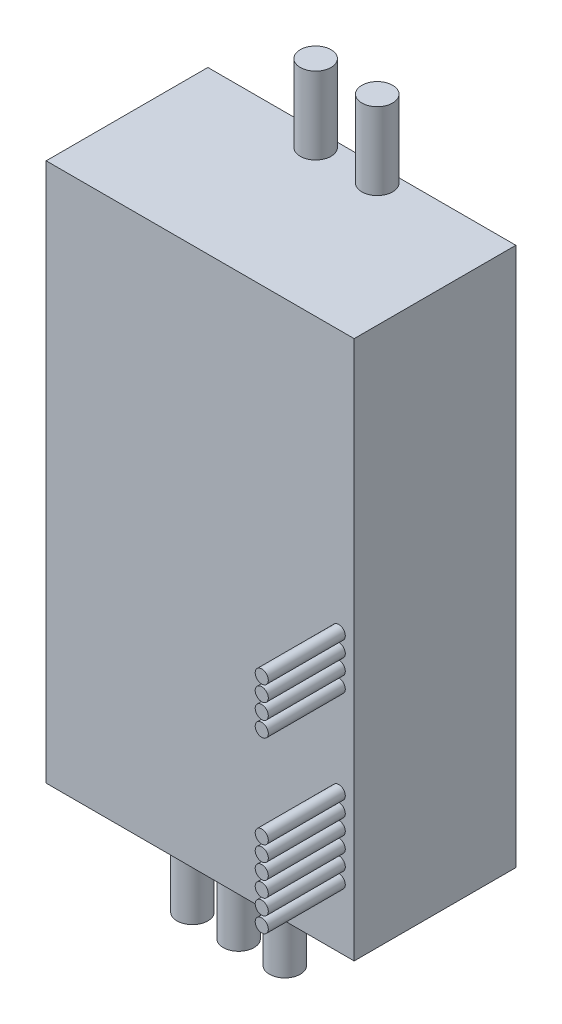
from build123d import *

# Parameters (mm, degrees)
SKETCH1_W           = 70
SKETCH1_H           = 40
BOSS_EXTRUDE1_DEPTH = 21
SKETCH2_R           = 2
BOSS_EXTRUDE2_DEPTH = 10
SKETCH3_R           = 2
BOSS_EXTRUDE3_DEPTH = 10
SKETCH4_R           = 0.85
BOSS_EXTRUDE4_DEPTH = 10


with BuildPart() as part:
    # Sketch1 → Boss-Extrude1 (new body)
    with BuildSketch(Plane(origin=(0, 0, 0), x_dir=(0, 1, 0), z_dir=(0, 0, 1))):
        Rectangle(SKETCH1_W, SKETCH1_H)
    extrude(amount=BOSS_EXTRUDE1_DEPTH)

    # Sketch2 → Boss-Extrude2 (add)
    with BuildSketch(Plane.XZ.offset(35)):
        with Locations((-6, 16)):
            Circle(SKETCH2_R)
        with Locations((0, 16)):
            Circle(SKETCH2_R)
        with Locations((6, 16)):
            Circle(SKETCH2_R)
    extrude(amount=BOSS_EXTRUDE2_DEPTH)

    # Sketch3 → Boss-Extrude3 (add)
    with BuildSketch(Plane(origin=(0, 35, 0), x_dir=(-1, 0, 0), z_dir=(0, 1, 0))):
        with Locations(Location((-4, 2, 0), (0, 0, 270))):
            Circle(SKETCH3_R)
        with Locations(Location((4, 2, 0), (0, 0, 270))):
            Circle(SKETCH3_R)
    extrude(amount=BOSS_EXTRUDE3_DEPTH)

    # Sketch4 → Boss-Extrude4 (add)
    with BuildSketch(Plane.XY.offset(21)):
        with Locations((18, -27)):
            Circle(SKETCH4_R)
        with Locations((18, -25)):
            Circle(SKETCH4_R)
        with Locations((18, -23)):
            Circle(SKETCH4_R)
        with Locations((18, -21)):
            Circle(SKETCH4_R)
        with Locations((18, -19)):
            Circle(SKETCH4_R)
        with Locations((18, -17)):
            Circle(SKETCH4_R)
        with Locations((18, -5)):
            Circle(SKETCH4_R)
        with Locations((18, -3)):
            Circle(SKETCH4_R)
        with Locations((18, -1)):
            Circle(SKETCH4_R)
        with Locations((18, 1)):
            Circle(SKETCH4_R)
    extrude(amount=BOSS_EXTRUDE4_DEPTH)


solid = part.part
